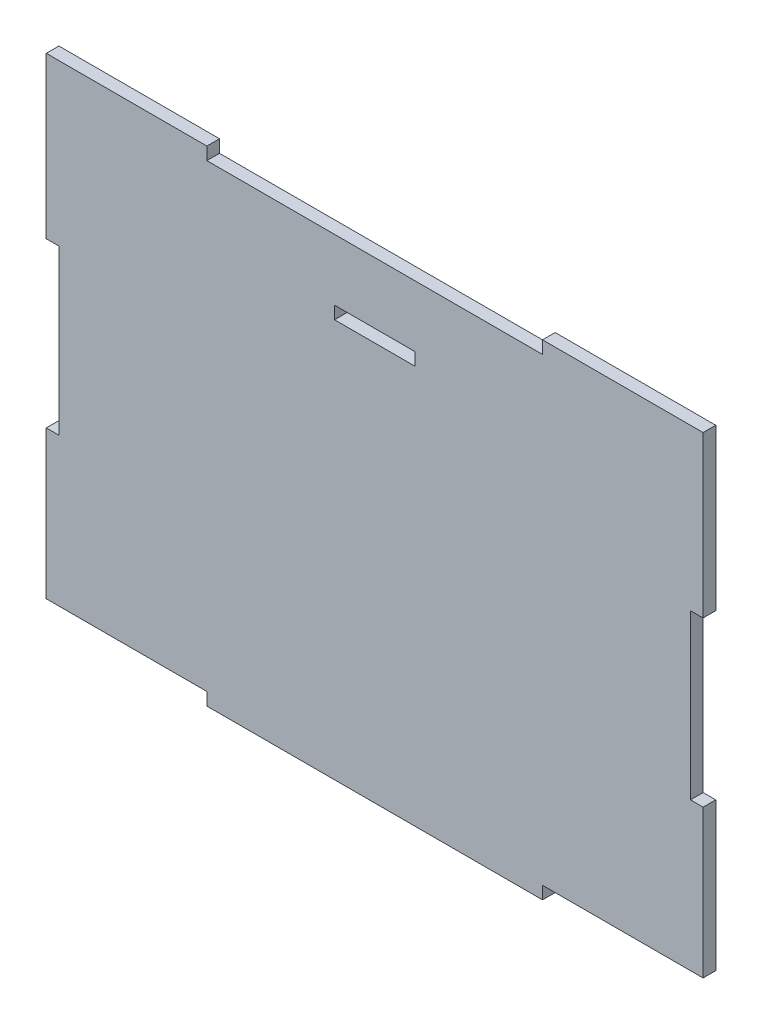
from build123d import *

# Parameters (mm, degrees)
SKETCH1_W           = 12.7
SKETCH1_H           = 2
BOSS_EXTRUDE1_DEPTH = 2


with BuildPart() as part:
    # Sketch1 → Boss-Extrude1 (new body)
    with BuildSketch(Plane.XY):
        Polygon((-26.543, 36.354), (26.543, 36.354), (26.543, 38.354), (51.943, 38.354), (51.943, 12.954), (49.943, 12.954), (49.943, -12.954), (51.943, -12.954), (51.943, -36.354), (49.943, -36.354), (26.543, -36.354), (26.543, -38.354), (-26.543, -38.354), (-26.543, -36.354), (-49.943, -36.354), (-51.943, -36.354), (-51.943, -12.954), (-49.943, -12.954), (-49.943, 12.954), (-51.943, 12.954), (-51.943, 38.354), (-26.543, 38.354), align=None)
        with Locations((0, 25.654)):
            Rectangle(SKETCH1_W, SKETCH1_H, mode=Mode.SUBTRACT)
    extrude(amount=BOSS_EXTRUDE1_DEPTH)


solid = part.part
